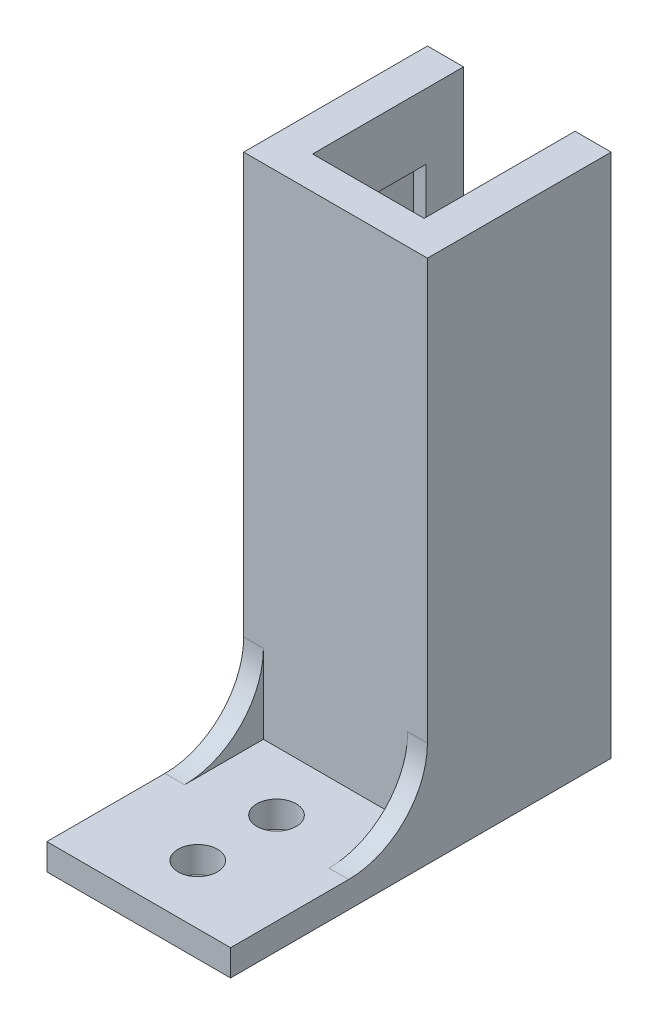
from build123d import *

# Parameters (mm, degrees)
SKETCH1_W           = 14
SKETCH1_H           = 40
BOSS_EXTRUDE1_DEPTH = 14
SKETCH2_W           = 10.4
SKETCH2_H           = 8.65
SKETCH2_W_2         = 8.5
SKETCH2_H_2         = 2.85
CUT_EXTRUDE1_DEPTH  = 35
SKETCH3_W           = 14
SKETCH3_H           = 15
SKETCH3_R           = 1.5
BOSS_EXTRUDE2_DEPTH = 2
BOSS_EXTRUDE3_DEPTH = 1.5
SKETCH5_W           = 8.5
SKETCH5_H           = 11.5
CUT_EXTRUDE2_DEPTH  = 46.98912915
SKETCH7_W           = 0.95
SKETCH7_H           = 8.65
BOSS_EXTRUDE4_DEPTH = 20


with BuildPart() as part:
    # Sketch1 → Boss-Extrude1 (new body)
    with BuildSketch(Plane.XY):
        Rectangle(SKETCH1_W, SKETCH1_H)
    extrude(amount=BOSS_EXTRUDE1_DEPTH)

    # Sketch2 → Cut-Extrude1 (cut)
    with BuildSketch(Plane.XZ.offset(20)):
        with Locations((0, 7.175)):
            Rectangle(SKETCH2_W, SKETCH2_H)
        with Locations((0, 1.425)):
            Rectangle(SKETCH2_W_2, SKETCH2_H_2)
    extrude(amount=-CUT_EXTRUDE1_DEPTH, mode=Mode.SUBTRACT)

    # Sketch3 → Boss-Extrude2 (add)
    with BuildSketch(Plane.XZ.offset(20)):
        with Locations((0, 21.5)):
            Rectangle(SKETCH3_W, SKETCH3_H)
        with Locations((0, 18.5)):
            Circle(SKETCH3_R, mode=Mode.SUBTRACT)
        with Locations((0, 24.5)):
            Circle(SKETCH3_R, mode=Mode.SUBTRACT)
    extrude(amount=-BOSS_EXTRUDE2_DEPTH)

    # Sketch4 → Boss-Extrude3 (add)
    with BuildSketch(Plane.ZY.offset(7)):
        with BuildLine():
            Line((14, -12), (14, -18))
            Line((14, -18), (20, -18))
            ThreePointArc((20, -18), (15.757359313, -16.242640687), (14, -12))
        make_face()
    boss_extrude3 = extrude(amount=-BOSS_EXTRUDE3_DEPTH)

    # Mirror1: Boss-Extrude3 across plane
    add(boss_extrude3.mirror(Plane(origin=(0, 0, 0), x_dir=(0, 0, 1), z_dir=(1, 0, 0))))

    # Sketch5 → Cut-Extrude2 (cut, through all)
    with BuildSketch(Plane.XZ.offset(-15)):
        with Locations((0, 5.75)):
            Rectangle(SKETCH5_W, SKETCH5_H)
    extrude(amount=-CUT_EXTRUDE2_DEPTH, mode=Mode.SUBTRACT)

    # Sketch7 → Boss-Extrude4 (add)
    with BuildSketch(Plane.XZ.offset(20)):
        with Locations((4.725, 7.175)):
            Rectangle(SKETCH7_W, SKETCH7_H)
        with Locations((-4.725, 7.175)):
            Rectangle(SKETCH7_W, SKETCH7_H)
    extrude(amount=-BOSS_EXTRUDE4_DEPTH)


solid = part.part
